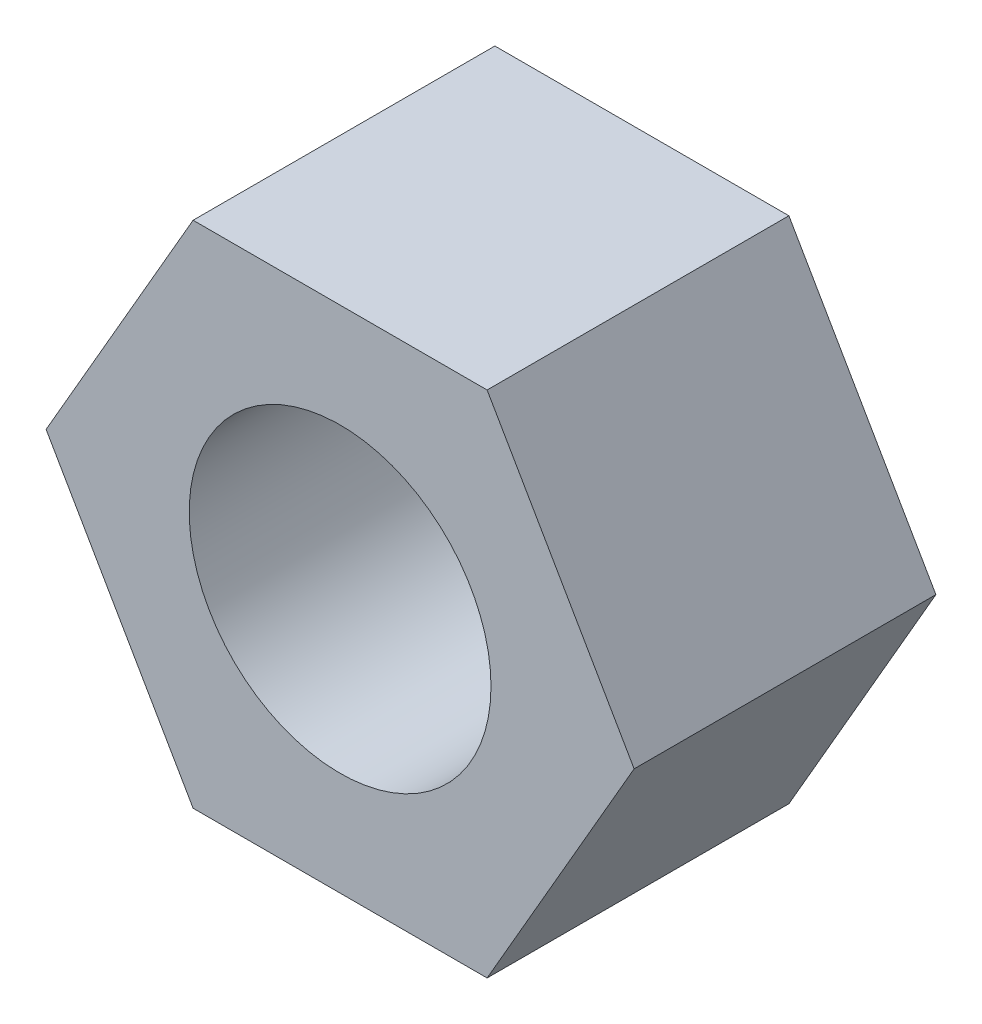
from build123d import *

# Parameters (mm, degrees)
SKETCH1_R           = 4
BOSS_EXTRUDE1_DEPTH = 8


with BuildPart() as part:
    # Sketch1 → Boss-Extrude1 (new body)
    with BuildSketch(Plane.XY):
        Polygon((7.794228634, 0), (3.897114317, 6.75), (-3.897114317, 6.75), (-7.794228634, 0), (-3.897114317, -6.75), (3.897114317, -6.75), align=None)
        Circle(SKETCH1_R, mode=Mode.SUBTRACT)
    extrude(amount=BOSS_EXTRUDE1_DEPTH)


solid = part.part
